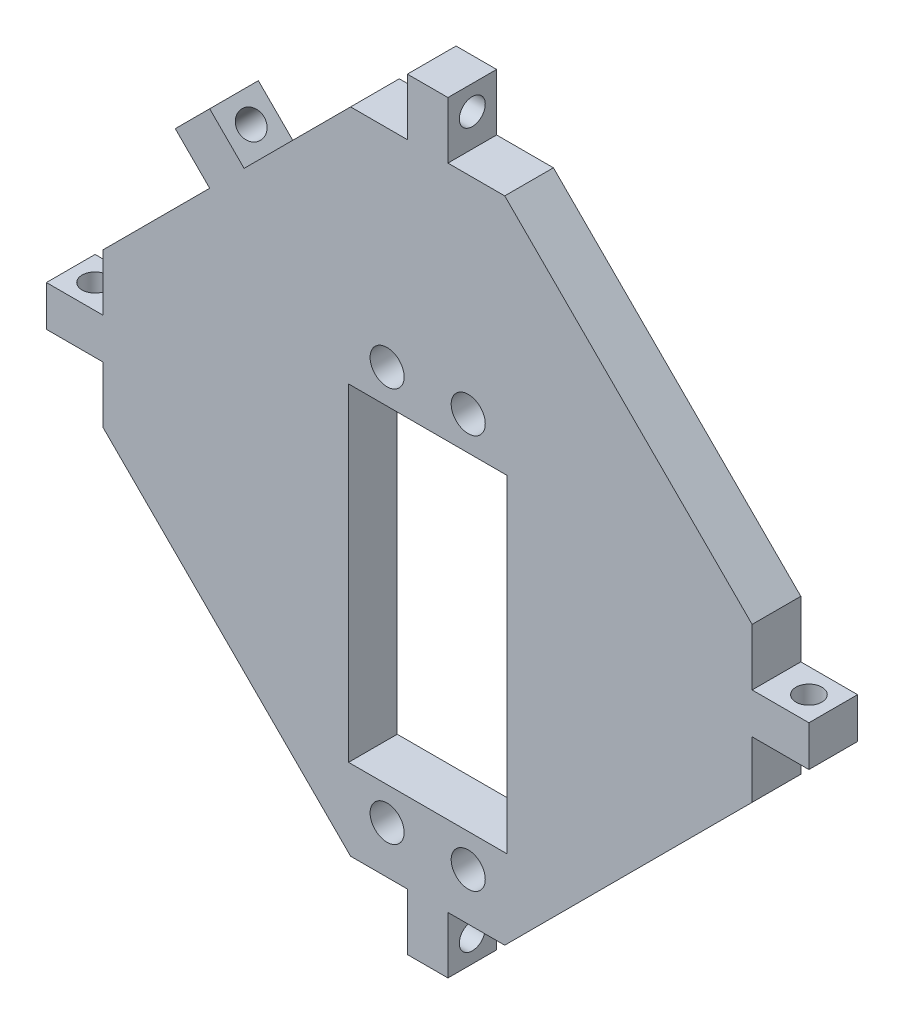
from build123d import *

# Parameters (mm, degrees)
SKETCH_1_R          = 2.1
SKETCH_1_W          = 5
SKETCH_1_H          = 7
SKETCH_1_W_2        = 7
SKETCH_1_H_2        = 5
SKETCH_1_W_3        = 19.5
SKETCH_1_H_3        = 6.75
EXTRUDE_2_DEPTH     = 6
SKETCH_2_R          = 1.6
CUT_EXTRUDE_1_DEPTH = 5
SKETCH_3_R          = 1.6
CUT_EXTRUDE_2_DEPTH = 5
SKETCH_4_R          = 1.6
CUT_EXTRUDE_3_DEPTH = 5
SKETCH_5_R          = 1.6
CUT_EXTRUDE_4_DEPTH = 5
EXTRUDE_3_DEPTH     = 6
SKETCH_7_R          = 1.6
CUT_EXTRUDE_5_DEPTH = 6


with BuildPart() as part:
    # 草图1 → 凸台-拉伸2 (new body)
    # profile 1 of 6: a face of its own
    with BuildSketch(Plane.XY):
        Polygon((-9.5, 39.997474683), (-39.997474683, 9.5), (-39.997474683, 2.5), (-39.997474683, -2.5), (-39.997474683, -9.5), (-9.5, -39.997474683), (-2.5, -39.997474683), (2.5, -39.997474683), (9.5, -39.997474683), (39.997474683, -9.5), (39.997474683, -2.5), (39.997474683, 2.5), (39.997474683, 9.5), (9.5, 39.997474683), (2.5, 39.997474683), (-2.5, 39.997474683), align=None)
        Polygon((-9.75, -30.1), (-9.75, 10.3), (9.75, 10.3), (9.75, -30.1), (9.75, -36.85), (-9.75, -36.85), align=None, mode=Mode.SUBTRACT)
        with Locations((-5, 14.465)):
            Circle(SKETCH_1_R, mode=Mode.SUBTRACT)
        with Locations((5, 14.465)):
            Circle(SKETCH_1_R, mode=Mode.SUBTRACT)
    # profile 2 of 6: a face of its own
    with BuildSketch(Plane.XY):
        with Locations((0, 43.497474683)):
            Rectangle(SKETCH_1_W, SKETCH_1_H)
    # profile 3 of 6: a face of its own
    with BuildSketch(Plane.XY):
        with Locations((-43.497474683, 0)):
            Rectangle(SKETCH_1_W_2, SKETCH_1_H_2)
    # profile 4 of 6: a face of its own
    with BuildSketch(Plane.XY):
        with Locations((0, -43.497474683)):
            Rectangle(SKETCH_1_W, SKETCH_1_H)
    # profile 5 of 6: a face of its own
    with BuildSketch(Plane.XY):
        with Locations((43.497474683, 0)):
            Rectangle(SKETCH_1_W_2, SKETCH_1_H_2)
    # profile 6 of 6: a face of its own
    with BuildSketch(Plane.XY):
        with Locations((0, -33.475)):
            Rectangle(SKETCH_1_W_3, SKETCH_1_H_3)
        with Locations((5, -34.165)):
            Circle(SKETCH_1_R, mode=Mode.SUBTRACT)
        with Locations((-5, -34.165)):
            Circle(SKETCH_1_R, mode=Mode.SUBTRACT)
    extrude(amount=EXTRUDE_2_DEPTH)

    # 草图2 → 切除-拉伸1 (cut)
    with BuildSketch(Plane.XZ.offset(2.5)):
        with Locations((-43.997474683, 3)):
            Circle(SKETCH_2_R)
    extrude(amount=-CUT_EXTRUDE_1_DEPTH, mode=Mode.SUBTRACT)

    # 草图3 → 切除-拉伸2 (cut)
    with BuildSketch(Plane(origin=(2.5, 0, 0), x_dir=(0, 0, -1), z_dir=(1, 0, 0))):
        with Locations(Location((-3, -43.997474683, 0), (0, 0, 90))):
            Circle(SKETCH_3_R)
    extrude(amount=-CUT_EXTRUDE_2_DEPTH, mode=Mode.SUBTRACT)

    # 草图4 → 切除-拉伸3 (cut)
    with BuildSketch(Plane(origin=(0, 2.5, 0), x_dir=(1, 0, 0), z_dir=(0, 1, 0))):
        with Locations(Location((43.997474683, -3, 0), (0, 0, 180))):
            Circle(SKETCH_4_R)
    extrude(amount=-CUT_EXTRUDE_3_DEPTH, mode=Mode.SUBTRACT)

    # 草图5 → 切除-拉伸4 (cut)
    with BuildSketch(Plane.ZY.offset(2.5)):
        with Locations(Location((3, 43.997474683, 0), (0, 0, 270))):
            Circle(SKETCH_5_R)
    extrude(amount=-CUT_EXTRUDE_4_DEPTH, mode=Mode.SUBTRACT)

    # 草图6 → 凸台-拉伸3 (add)
    with BuildSketch(Plane.XY.offset(6)):
        Polygon((-26.870057685, 22.627416998), (-24.748737342, 24.748737342), (-28.991378029, 28.991378029), (-31.112698372, 26.870057685), align=None)
        Polygon((-24.748737342, 24.748737342), (-22.627416998, 26.870057685), (-26.870057685, 31.112698372), (-28.991378029, 28.991378029), align=None)
    extrude(amount=-EXTRUDE_3_DEPTH)

    # 草图7 → 切除-拉伸5 (cut)
    with BuildSketch(Plane(origin=(-2.121320344, -2.121320344, 0), x_dir=(0, 0, 1), z_dir=(-0.7071067811865471, -0.7071067811865479, 0))):
        with Locations(Location((3, 38, 0), (0, 0, 270))):
            Circle(SKETCH_7_R)
    extrude(amount=-CUT_EXTRUDE_5_DEPTH, mode=Mode.SUBTRACT)


solid = part.part
